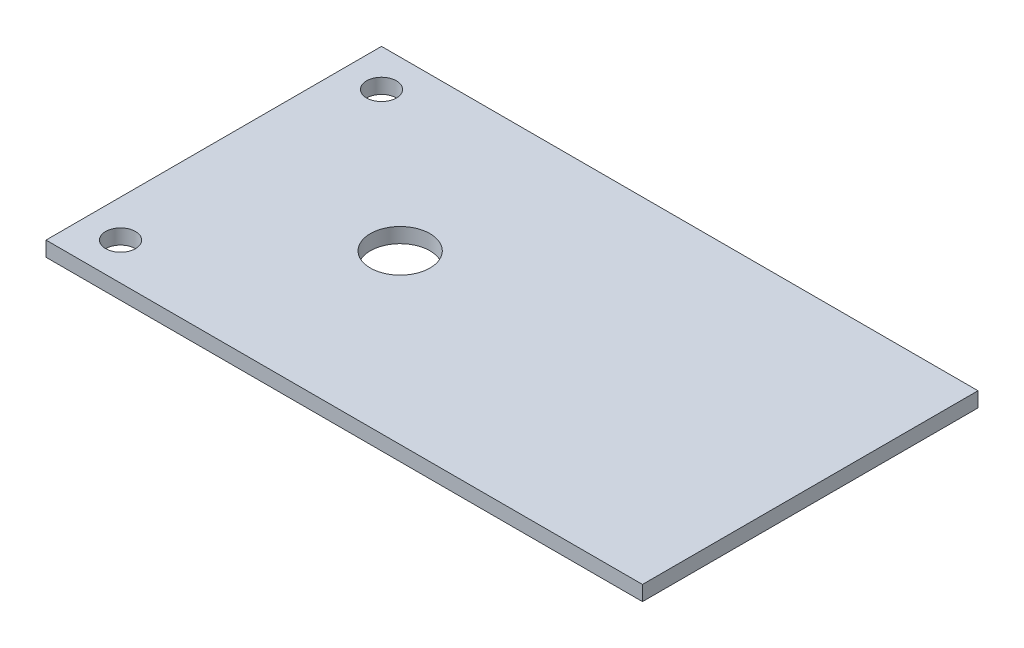
from build123d import *

# Parameters (mm, degrees)
SKETCH1_W      = 160
SKETCH1_H      = 90
SKETCH1_R      = 4
SKETCH1_R_2    = 8
EXTRUDE1_DEPTH = 4


with BuildPart() as part:
    # Sketch1 → Extrude1 (new body)
    with BuildSketch(Plane(origin=(0, 0, 0), x_dir=(1, 0, 0), z_dir=(0, 1, 0))):
        with Locations((80, 45)):
            Rectangle(SKETCH1_W, SKETCH1_H)
        with Locations(Location((10, 10, 0), (0, 0, 270))):
            Circle(SKETCH1_R, mode=Mode.SUBTRACT)
        with Locations(Location((10, 80, 0), (0, 0, 270))):
            Circle(SKETCH1_R, mode=Mode.SUBTRACT)
        with Locations(Location((50, 45, 0), (0, 0, 270))):
            Circle(SKETCH1_R_2, mode=Mode.SUBTRACT)
    extrude(amount=EXTRUDE1_DEPTH)


solid = part.part
